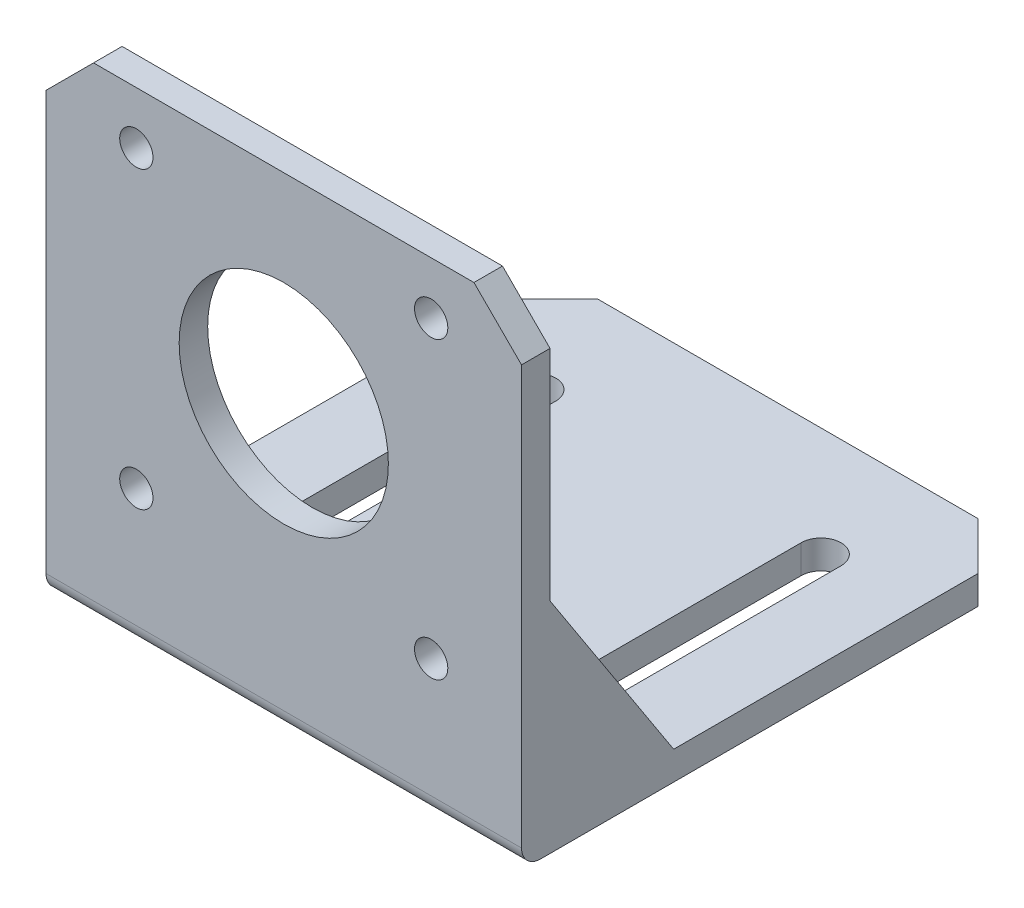
from build123d import *

# Parameters (mm, degrees)
EXTRUDE_1_DEPTH     = 50
EXTRUDE_2_DEPTH     = 3
EXTRUDE_START       = -3
EXTRUDE_3_DEPTH     = 3
SKETCH_5_R          = 11
SKETCH_5_R_2        = 1.75
CUT_EXTRUDE_1_DEPTH = 3
CUT_EXTRUDE_2_DEPTH = 11
CHAMFER_1_SIZE      = 5


with BuildPart() as part:
    # 草图1 → 凸台-拉伸1 (new body)
    with BuildSketch(Plane(origin=(0, 0, 0), x_dir=(0, 0, -1), z_dir=(1, 0, 0))):
        with BuildLine():
            Line((0, 2), (0, 51))
            Line((0, 51), (3, 51))
            Line((3, 51), (3, 5))
            ThreePointArc((3, 5), (3.585786438, 3.585786438), (5, 3))
            Line((5, 3), (53, 3))
            Line((53, 3), (53, 0))
            Line((53, 0), (2, 0))
            ThreePointArc((2, 0), (0.585786438, 0.585786438), (0, 2))
        make_face()
    extrude(amount=EXTRUDE_1_DEPTH)

    # 草图3 → 凸台-拉伸2 (add)
    with BuildSketch(Plane(origin=(0, 0, 0), x_dir=(0, 0, -1), z_dir=(1, 0, 0))):
        with BuildLine():
            Line((3, 5), (3, 23))
            Line((3, 23), (16, 3))
            Line((16, 3), (5, 3))
            ThreePointArc((5, 3), (3.585786438, 3.585786438), (3, 5))
        make_face()
    extrude(amount=EXTRUDE_2_DEPTH)

    # 草图4 → 凸台-拉伸3 (add)
    with BuildSketch(Plane(origin=(50, 0, 0), x_dir=(0, 0, -1), z_dir=(1, 0, 0)).offset(EXTRUDE_START)):
        with BuildLine():
            Line((3, 23), (3, 5))
            ThreePointArc((3, 5), (3.585786438, 3.585786438), (5, 3))
            Line((5, 3), (16, 3))
            Line((16, 3), (3, 23))
        make_face()
    extrude(amount=EXTRUDE_3_DEPTH)

    # 草图5 → 切除-拉伸1 (cut)
    with BuildSketch(Plane.XY):
        with Locations((25, 30)):
            Circle(SKETCH_5_R)
        with Locations((9.5, 45.5)):
            Circle(SKETCH_5_R_2)
        with Locations((40.5, 45.5)):
            Circle(SKETCH_5_R_2)
        with Locations((9.5, 14.5)):
            Circle(SKETCH_5_R_2)
        with Locations((40.5, 14.5)):
            Circle(SKETCH_5_R_2)
    extrude(amount=-CUT_EXTRUDE_1_DEPTH, mode=Mode.SUBTRACT)

    # 草图6 → 切除-拉伸2 (cut)
    with BuildSketch(Plane(origin=(0, 0, 0), x_dir=(1, 0, 0), z_dir=(0, 1, 0))):
        with BuildLine():
            Line((7.9, 41.5), (7.9, 11.5))
            ThreePointArc((7.9, 11.5), (10, 9.4), (12.1, 11.5))
            Line((12.1, 11.5), (12.1, 41.5))
            ThreePointArc((12.1, 41.5), (10, 43.6), (7.9, 41.5))
        make_face()
        with BuildLine():
            Line((37.9, 41.5), (37.9, 11.5))
            ThreePointArc((37.9, 11.5), (40, 9.4), (42.1, 11.5))
            Line((42.1, 11.5), (42.1, 41.5))
            ThreePointArc((42.1, 41.5), (40, 43.6), (37.9, 41.5))
        make_face()
    extrude(amount=CUT_EXTRUDE_2_DEPTH, mode=Mode.SUBTRACT)

    # 倒角1
    chamfer_1_edges = [part.edges().sort_by_distance(p)[0] for p in [
        (0, 51, -1.5),
        (50, 1.5, -53),
        (50, 51, -1.5),
        (0, 1.5, -53),
    ]]
    chamfer(chamfer_1_edges, length=CHAMFER_1_SIZE)


solid = part.part
